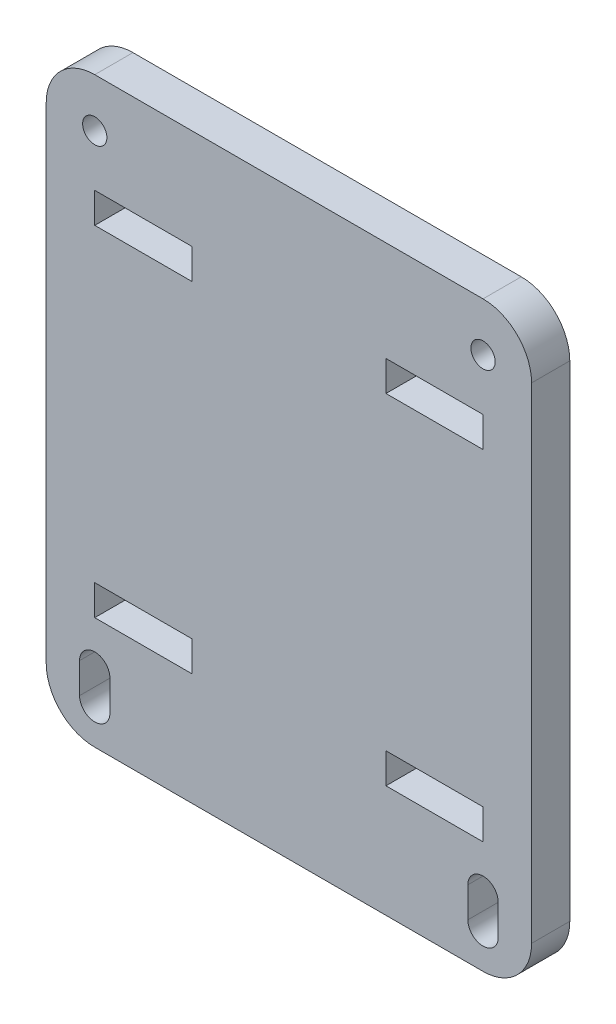
from build123d import *

# Parameters (mm, degrees)
SKETCH1_W            = 127
SKETCH1_H            = 152.4
BOSS_EXTRUDE1_DEPTH  = 10
SKETCH2_W            = 25.4
SKETCH2_H            = 7.9375
CUT_EXTRUDE1_DEPTH   = 10
LPATTERN1_COUNT      = 2
LPATTERN1_PITCH      = 76.2
LPATTERN1_COUNT_DIR2 = 2
LPATTERN1_PITCH_DIR2 = 88.9
SKETCH3_R            = 3.175
CUT_EXTRUDE2_DEPTH   = 10
LPATTERN2_COUNT      = 2
LPATTERN2_PITCH      = 101.6
CUT_EXTRUDE3_DEPTH   = 10
LPATTERN3_COUNT      = 2
LPATTERN3_PITCH      = 101.6
FILLET1_R            = 12.7
FILLET2_R            = 12.7


with BuildPart() as part:
    # Sketch1 → Boss-Extrude1 (new body)
    with BuildSketch(Plane.XY):
        with Locations((-63.5, 76.2)):
            Rectangle(SKETCH1_W, SKETCH1_H)
    extrude(amount=BOSS_EXTRUDE1_DEPTH)

    # Sketch2 → Cut-Extrude1 (cut)
    with BuildSketch(Plane.XY.offset(10)):
        with Locations((-101.6, 122.22353)):
            Rectangle(SKETCH2_W, SKETCH2_H)
    cut_extrude1 = extrude(amount=-CUT_EXTRUDE1_DEPTH, mode=Mode.SUBTRACT)

    # LPattern1: Cut-Extrude1 2 × 2
    with Locations(*[(i * LPATTERN1_PITCH, -j * LPATTERN1_PITCH_DIR2, 0) for i in range(LPATTERN1_COUNT) for j in range(LPATTERN1_COUNT_DIR2) if (i, j) != (0, 0)]):
        add(cut_extrude1, mode=Mode.SUBTRACT)

    # Sketch3 → Cut-Extrude2 (cut)
    with BuildSketch(Plane.XY.offset(10)):
        with Locations((-114.3, 139.7)):
            Circle(SKETCH3_R)
    cut_extrude2 = extrude(amount=-CUT_EXTRUDE2_DEPTH, mode=Mode.SUBTRACT)

    # LPattern2: Cut-Extrude2 ×2
    with Locations(*[(i * LPATTERN2_PITCH, 0, 0) for i in range(1, LPATTERN2_COUNT)]):
        add(cut_extrude2, mode=Mode.SUBTRACT)

    # Sketch4 → Cut-Extrude3 (cut)
    with BuildSketch(Plane.XY.offset(10)):
        with BuildLine():
            Line((-110.32998, 17.6403), (-110.32998, 9.7028))
            ThreePointArc((-110.32998, 9.7028), (-114.3, 5.73278), (-118.27002, 9.7028))
            Line((-118.27002, 9.7028), (-118.27002, 17.6403))
            ThreePointArc((-118.27002, 17.6403), (-114.3, 21.61032), (-110.32998, 17.6403))
        make_face()
    cut_extrude3 = extrude(amount=-CUT_EXTRUDE3_DEPTH, mode=Mode.SUBTRACT)

    # LPattern3: Cut-Extrude3 ×2
    with Locations(*[(i * LPATTERN3_PITCH, 0, 0) for i in range(1, LPATTERN3_COUNT)]):
        add(cut_extrude3, mode=Mode.SUBTRACT)

    # Fillet1
    fillet1_edges = [part.edges().sort_by_distance(p)[0] for p in [
        (0, 152.4, 5),
    ]]
    fillet(fillet1_edges, radius=FILLET1_R)

    # Fillet2
    fillet2_edges = [part.edges().sort_by_distance(p)[0] for p in [
        (-127, 152.4, 5),
        (0, 0, 5),
        (-127, 0, 5),
    ]]
    fillet(fillet2_edges, radius=FILLET2_R)


solid = part.part
